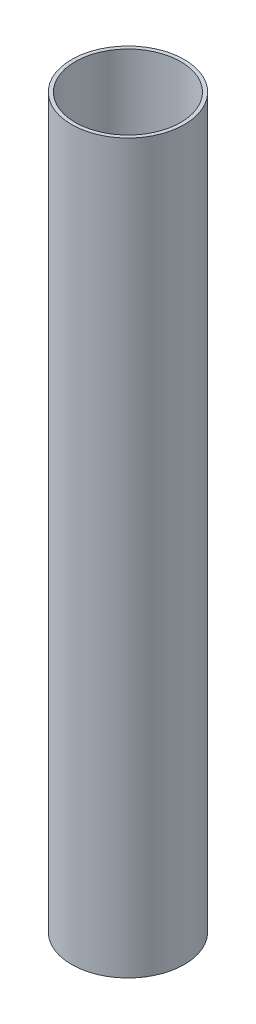
from build123d import *

# Parameters (mm, degrees)
SKETCH1_R           = 15.5
SKETCH1_R_2         = 14.5
BOSS_EXTRUDE1_DEPTH = 200


with BuildPart() as part:
    # Sketch1 → Boss-Extrude1 (new body)
    with BuildSketch(Plane(origin=(0, 0, 0), x_dir=(1, 0, 0), z_dir=(0, 1, 0))):
        with Locations(Location((0, 0, 0), (0, 0, 270))):
            Circle(SKETCH1_R)
        with Locations(Location((0, 0, 0), (0, 0, 270))):
            Circle(SKETCH1_R_2, mode=Mode.SUBTRACT)
    extrude(amount=BOSS_EXTRUDE1_DEPTH)


solid = part.part
